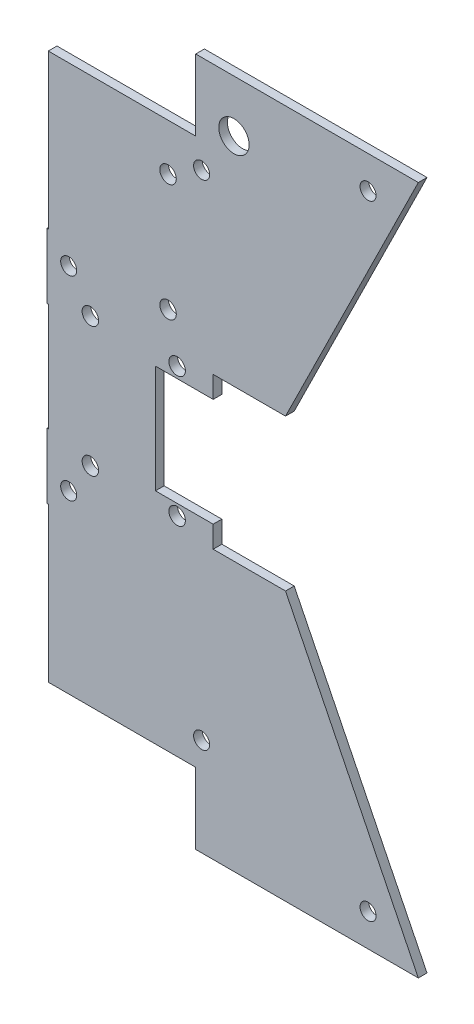
from build123d import *

# Parameters (mm, degrees)
SKETCH1_R           = 2.3495
SKETCH1_R_2         = 4.445
BOSS_EXTRUDE1_DEPTH = 2.54
SKETCH2_R           = 2.413
CUT_EXTRUDE1_DEPTH  = 217.884748371
SKETCH3_W           = 16.89488816
SKETCH3_H           = 31.623
CUT_EXTRUDE2_DEPTH  = 217.884748371
SKETCH4_W           = 12.77569874
SKETCH4_H           = 24.435209008
SKETCH4_W_2         = 40.233428475
SKETCH4_H_2         = 28.333759116
CUT_EXTRUDE3_DEPTH  = 217.884748371
SKETCH5_R           = 2.413
CUT_EXTRUDE4_DEPTH  = 217.884748371


with BuildPart() as part:
    # Sketch1 → Boss-Extrude1 (new body)
    with BuildSketch(Plane.XY):
        Polygon((-2.930050059, -104.509781075), (-3.314938219, -104.509781075), (-3.314938219, -110.859781075), (-3.314938219, -123.559781075), (-2.930050059, -123.559781075), (-2.930050059, -168.708281075), (38.709428475, -168.708281075), (38.709428475, -189.536281075), (105.397061781, -189.536281075), (66.517436481, -110.859781075), (45.329949941, -110.859781075), (45.329949941, -104.509781075), (45.329949941, -72.886781075), (45.329949941, -66.536781075), (66.517436481, -66.536781075), (105.397061781, 12.139718925), (38.709428475, 12.139718925), (38.709428475, -8.688281075), (-2.930050059, -8.688281075), (-2.930050059, -53.836781075), (-3.314938219, -53.836781075), (-3.314938219, -66.536781075), (-3.314938219, -72.886781075), (-2.930050059, -72.886781075), align=None)
        with Locations((90.673911143, 2.614718925)):
            Circle(SKETCH1_R, mode=Mode.SUBTRACT)
        with Locations((41.95655448, -16.435281075)):
            Circle(SKETCH1_R, mode=Mode.SUBTRACT)
        with Locations((3.035061781, -60.186781075)):
            Circle(SKETCH1_R, mode=Mode.SUBTRACT)
        with Locations((3.035061781, -117.209781075)):
            Circle(SKETCH1_R, mode=Mode.SUBTRACT)
        with Locations((41.95655448, -160.961281075)):
            Circle(SKETCH1_R, mode=Mode.SUBTRACT)
        with Locations((90.673911143, -180.011281075)):
            Circle(SKETCH1_R, mode=Mode.SUBTRACT)
        with Locations((51.409428475, -3.100281075)):
            Circle(SKETCH1_R_2, mode=Mode.SUBTRACT)
    extrude(amount=BOSS_EXTRUDE1_DEPTH)

    # Sketch2 → Cut-Extrude1 (cut, through all)
    with BuildSketch(Plane.XY.offset(2.54)):
        with Locations((9.385061781, -69.711781075)):
            Circle(SKETCH2_R)
        with Locations((34.785061781, -69.711781075)):
            Circle(SKETCH2_R)
        with Locations(Location((34.785061781, -107.684781075, 0), (0, 0, 180))):
            Circle(SKETCH2_R)
        with Locations(Location((9.385061781, -107.684781075, 0), (0, 0, 180))):
            Circle(SKETCH2_R)
    extrude(amount=-CUT_EXTRUDE1_DEPTH, mode=Mode.SUBTRACT)

    # Sketch3 → Cut-Extrude2 (cut, through all)
    with BuildSketch(Plane.XY.offset(2.54)):
        with Locations((36.882505861, -88.698281075)):
            Rectangle(SKETCH3_W, SKETCH3_H)
    extrude(amount=-CUT_EXTRUDE2_DEPTH, mode=Mode.SUBTRACT)

    # Sketch4 → Cut-Extrude3 (cut, through all)
    with BuildSketch(Plane.XY.offset(2.54)):
        with Locations((33.845579105, 3.529323429)):
            Rectangle(SKETCH4_W, SKETCH4_H)
        with Locations((20.116714238, -182.875160633)):
            Rectangle(SKETCH4_W_2, SKETCH4_H_2)
    extrude(amount=-CUT_EXTRUDE3_DEPTH, mode=Mode.SUBTRACT)

    # Sketch5 → Cut-Extrude4 (cut, through all)
    with BuildSketch(Plane(origin=(0, 0, 0), x_dir=(-1, 0, 0), z_dir=(0, 0, -1))):
        with Locations((-32.121949941, -22.404281075)):
            Circle(SKETCH5_R)
        with Locations((-32.121949941, -56.694281075)):
            Circle(SKETCH5_R)
    extrude(amount=-CUT_EXTRUDE4_DEPTH, mode=Mode.SUBTRACT)


solid = part.part
